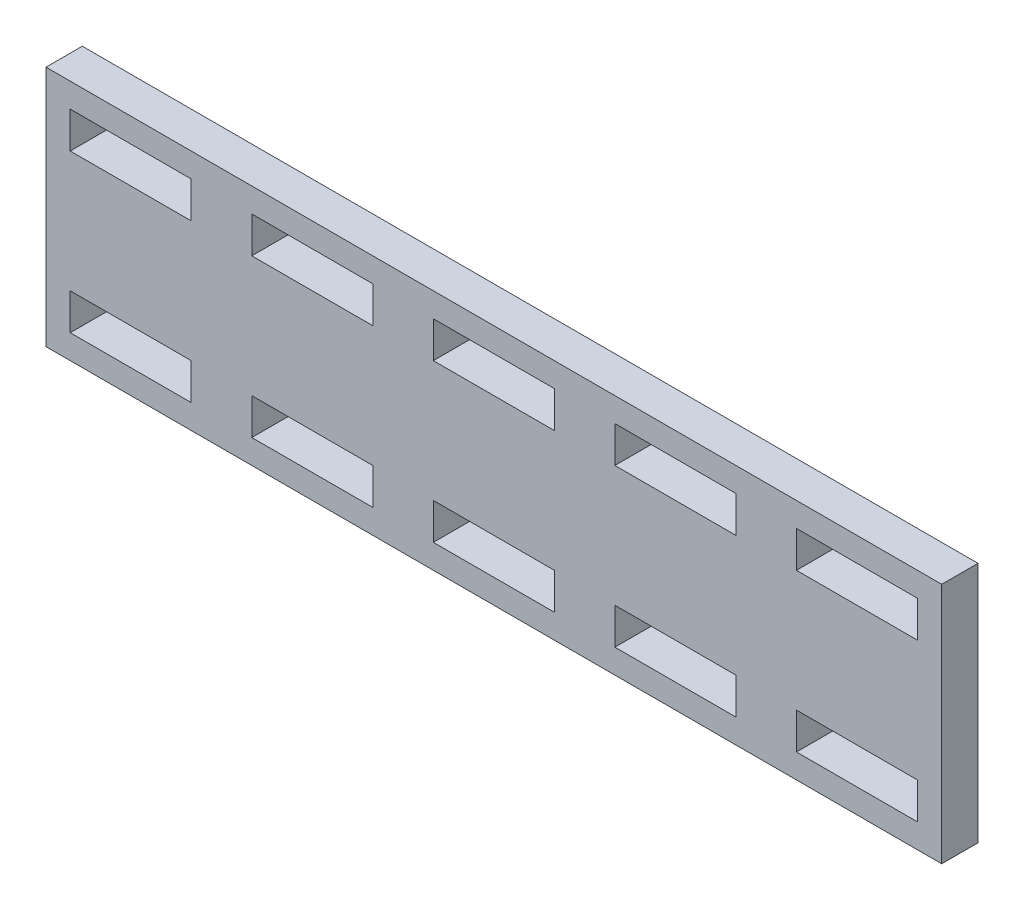
from build123d import *

# Parameters (mm, degrees)
SKETCH_1_W      = 10
SKETCH_1_H      = 3
EXTRUDE_3_DEPTH = 3


with BuildPart() as part:
    # 草图1 → 凸台-拉伸3 (new body)
    with BuildSketch(Plane.XY):
        Polygon((-37, 5), (-37, -5), (-37, -10), (37, -10), (37, -5), (37, 5), (37, 10), (-37, 10), align=None)
        with Locations((-15, 6.5)):
            Rectangle(SKETCH_1_W, SKETCH_1_H, mode=Mode.SUBTRACT)
        with Locations((-30, 6.5)):
            Rectangle(SKETCH_1_W, SKETCH_1_H, mode=Mode.SUBTRACT)
        with Locations((0, 6.5)):
            Rectangle(SKETCH_1_W, SKETCH_1_H, mode=Mode.SUBTRACT)
        with Locations((15, 6.5)):
            Rectangle(SKETCH_1_W, SKETCH_1_H, mode=Mode.SUBTRACT)
        with Locations((30, 6.5)):
            Rectangle(SKETCH_1_W, SKETCH_1_H, mode=Mode.SUBTRACT)
        with Locations((30, -6.5)):
            Rectangle(SKETCH_1_W, SKETCH_1_H, mode=Mode.SUBTRACT)
        with Locations((15, -6.5)):
            Rectangle(SKETCH_1_W, SKETCH_1_H, mode=Mode.SUBTRACT)
        with Locations((0, -6.5)):
            Rectangle(SKETCH_1_W, SKETCH_1_H, mode=Mode.SUBTRACT)
        with Locations((-15, -6.5)):
            Rectangle(SKETCH_1_W, SKETCH_1_H, mode=Mode.SUBTRACT)
        with Locations((-30, -6.5)):
            Rectangle(SKETCH_1_W, SKETCH_1_H, mode=Mode.SUBTRACT)
    extrude(amount=EXTRUDE_3_DEPTH)


solid = part.part
